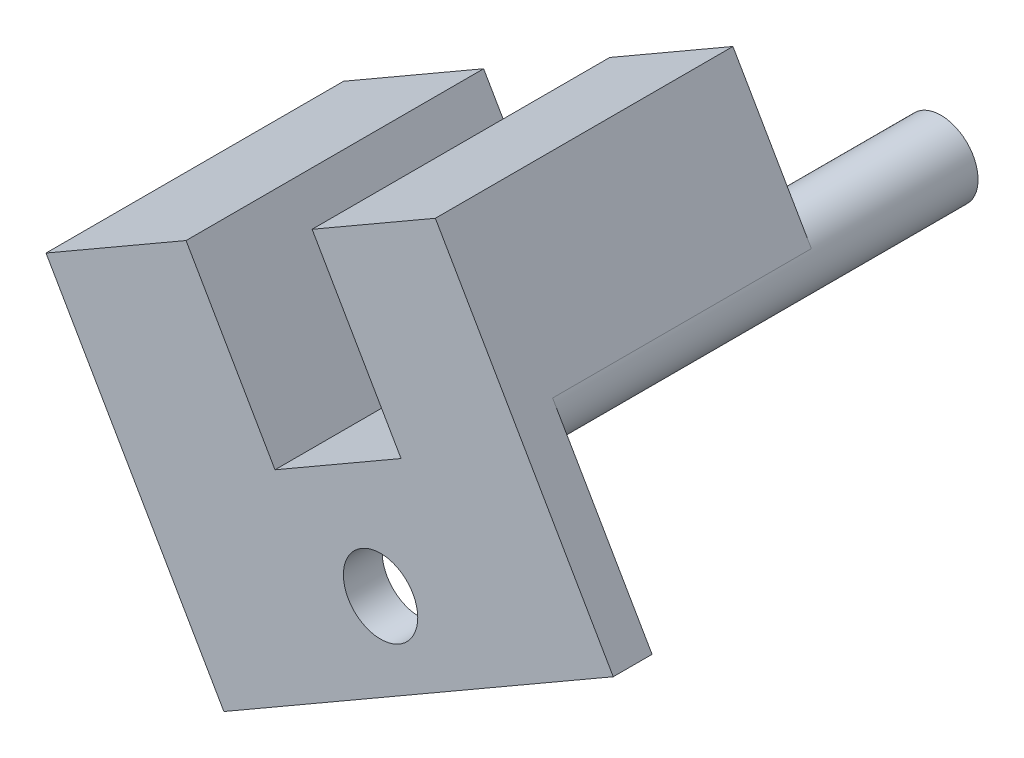
from build123d import *

# Parameters (mm, degrees)
EXTRUSION1_DEPTH = 8
ESQUISSE2_R      = 1.15
EXTRUSION2_DEPTH = 1.2
EXTRUSION3_START = 5
EXTRUSION3_DEPTH = 5


with BuildPart() as part:
    # Esquisse1 → Extrusion1 (new body)
    with BuildSketch(Plane.XY):
        with BuildLine():
            Line((-14.760065323, -47.656078111), (-4.714170639, -41.856078111))
            ThreePointArc((-4.714170639, -41.856078111), (-4.178355938, -41.157790798), (-4.293241424, -40.285148896))
            Line((-4.293241424, -40.285148896), (-6.718241424, -36.084925688))
            Line((-6.718241424, -36.084925688), (-10.528753201, -38.284925688))
            Line((-10.528753201, -38.284925688), (-7.778753201, -43.048065409))
            Line((-7.778753201, -43.048065409), (-11.675867518, -45.298065409))
            Line((-11.675867518, -45.298065409), (-14.425867518, -40.534925688))
            Line((-14.425867518, -40.534925688), (-18.755994537, -43.034925688))
            Line((-18.755994537, -43.034925688), (-16.330994537, -47.235148896))
            ThreePointArc((-16.330994537, -47.235148896), (-15.632707224, -47.770963597), (-14.760065323, -47.656078111))
        make_face()
    extrude(amount=EXTRUSION1_DEPTH)

    # Esquisse2 → Extrusion2 (add)
    with BuildSketch(Plane.XY.offset(8)):
        Polygon((-18.755994537, -43.034925688), (-16.330994537, -47.235148896), (-13.255994537, -52.56120513), (-1.218241424, -45.61120513), (-4.293241424, -40.285148896), (-6.718241424, -36.084925688), (-10.528753201, -38.284925688), (-7.778753201, -43.048065409), (-11.675867518, -45.298065409), (-14.425867518, -40.534925688), align=None)
        with Locations((-8.412117981, -47.051045431)):
            Circle(ESQUISSE2_R, mode=Mode.SUBTRACT)
    extrude(amount=EXTRUSION2_DEPTH)

    # Esquisse3 → Extrusion3 (add)
    with BuildSketch(Plane(origin=(0, 0, 0), x_dir=(-1, 0, 0), z_dir=(0, 0, -1)).offset(EXTRUSION3_START)):
        with BuildLine():
            ThreePointArc((4.714170639, -41.856078111), (5.864170639, -41.856078111), (6.439170639, -40.860148896))
            ThreePointArc((6.439170639, -40.860148896), (5.586812541, -39.749334196), (4.293241424, -40.285148896))
            ThreePointArc((4.293241424, -40.285148896), (4.178355938, -41.157790798), (4.714170639, -41.856078111))
        make_face()
        with BuildLine():
            ThreePointArc((16.330994537, -47.235148896), (16.445880023, -46.957790798), (16.485065323, -46.660148896))
            ThreePointArc((16.485065323, -46.660148896), (14.760065323, -45.664219682), (14.760065323, -47.656078111))
            ThreePointArc((14.760065323, -47.656078111), (15.632707224, -47.770963597), (16.330994537, -47.235148896))
        make_face()
    extrude(amount=-EXTRUSION3_DEPTH)


solid = part.part
